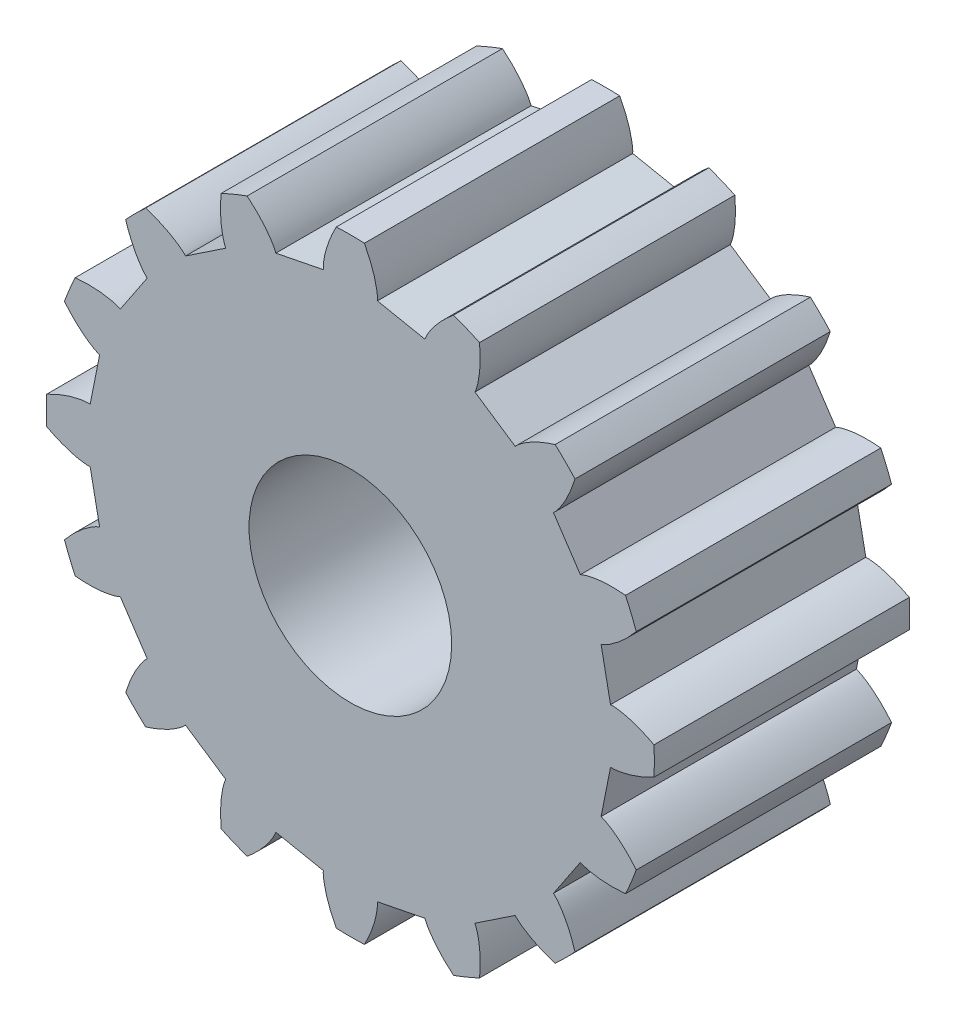
from build123d import *

# Parameters (mm, degrees)
SKETCH1_R               = 14.2875
BOSS_EXTRUDE1_DEPTH     = 12
CUT_EXTRUDE2_DEPTH      = 13
CIRPATTERN1_COUNT       = 16
CUT_EXTRUDE4_DEPTH      = 14
CUT_EXTRUDE4_DEPTH_BACK = 14
SKETCH3_R               = 4.7625


with BuildPart() as part:
    # Sketch1 → Boss-Extrude1 (new body)
    with BuildSketch(Plane.XY):
        Circle(SKETCH1_R)
    extrude(amount=BOSS_EXTRUDE1_DEPTH)

    # Sketch2 → Cut-Extrude2 (cut, symmetric)
    with BuildSketch(Plane.XY):
        with BuildLine():
            add(Edge.make_bspline(
                [(12.229398428, 1.272996615), (12.232569464, 1.273286616), (12.24147496, 1.27397705), (12.258355017, 1.274796659), (12.285950585, 1.275443331), (12.321178928, 1.275251476), (12.366773102, 1.273836189), (12.420546418, 1.270667153), (12.479687741, 1.26561074), (12.544059737, 1.258411302), (12.608289269, 1.249727247), (12.672354395, 1.239667418), (12.736156846, 1.228386466), (12.813405758, 1.213233983), (12.905973255, 1.192997232), (13.01403689, 1.166335588), (13.136405998, 1.132550383), (13.260856391, 1.094333587), (13.383078241, 1.05362131), (13.506236131, 1.00892567), (13.625159484, 0.963157367), (13.74827665, 0.911985231), (13.861717136, 0.862901529), (13.98829551, 0.803906078), (14.090299927, 0.755125575), (14.195197101, 0.701408819), (14.246179434, 0.67477432), (14.272203516, 0.660956172)],
                knots=[0, 0, 0, 0, 0, 0.005376749, 0.015083688, 0.02853182, 0.04661014, 0.064854849, 0.092110526, 0.119476176, 0.146842496, 0.174208854, 0.201574956, 0.228941013, 0.256307345, 0.307035032, 0.361767352, 0.416499661, 0.471231937, 0.525964282, 0.580696616, 0.635428982, 0.690161387, 0.744893688, 0.799626082, 0.854358407, 0.909090914, 0.909090914, 0.909090914, 0.909090914, 0.909090914], degree=4))
            Line((14.272203516, 0.660956172), (59.935762795, 2.775668965))
            add(Edge.make_bspline(
                [(59.935762795, 2.775668965), (59.931630356, 2.864901825), (59.922571104, 3.049480891), (59.902165694, 3.440419569), (59.877579242, 3.838864849), (59.840808515, 4.384473066), (59.791455691, 5.01973039), (59.724470289, 5.770803476), (59.636018849, 6.621628164), (59.535214074, 7.474533703), (59.422361052, 8.323878311), (59.297279712, 9.17280178), (59.160175965, 10.018977678), (59.010873176, 10.863801486), (58.849682784, 11.705714261), (58.676209407, 12.546100116), (58.491172454, 13.382667924), (58.293497058, 14.218465783), (58.085046948, 15.048188716), (57.862866002, 15.880024995), (57.631950551, 16.700058452), (57.384099029, 17.530991619), (57.133463512, 18.333578353), (56.889087073, 19.073728923), (56.697889707, 19.634977834), (56.527852443, 20.11504821), (56.4659571, 20.288017853), (56.435627038, 20.372039682)],
                knots=[0.083333333, 0.083333333, 0.083333333, 0.083333333, 0.083333333, 0.103174603, 0.123015873, 0.142857143, 0.162698412, 0.202380952, 0.242063492, 0.281746032, 0.321428571, 0.361111111, 0.400793651, 0.44047619, 0.48015873, 0.51984127, 0.55952381, 0.599206349, 0.638888889, 0.678571429, 0.718253968, 0.757936508, 0.797619048, 0.837301588, 0.876984127, 0.896825397, 0.916666667, 0.916666667, 0.916666667, 0.916666667, 0.916666667], degree=4))
            Line((56.435627038, 20.372039682), (13.438733689, 4.851091949))
            add(Edge.make_bspline(
                [(11.785645616, 3.503892648), (11.78868625, 3.504838225), (11.797178074, 3.507608333), (11.813086863, 3.513310832), (11.838829315, 3.523273751), (11.87130264, 3.536932305), (11.912884557, 3.555687995), (11.961351885, 3.579193959), (12.014056338, 3.606497881), (12.070773202, 3.63778339), (12.126790307, 3.670385988), (12.182129036, 3.704196722), (12.236757782, 3.739035103), (12.302327866, 3.78259605), (12.380104813, 3.836716418), (12.469739624, 3.902702728), (12.5698649, 3.980744818), (12.670217137, 4.063677637), (12.767555488, 4.148063154), (12.864234261, 4.236487024), (12.956590341, 4.324281419), (13.050753042, 4.418673208), (13.136774866, 4.507432431), (13.231141453, 4.610376567), (13.306713757, 4.694479276), (13.383069595, 4.784249498), (13.419978548, 4.82836666), (13.438733689, 4.851091949)],
                knots=[0, 0, 0, 0, 0, 0.005376749, 0.015083688, 0.02853182, 0.04661014, 0.064854849, 0.092110526, 0.119476176, 0.146842496, 0.174208854, 0.201574956, 0.228941013, 0.256307345, 0.307035032, 0.361767352, 0.416499661, 0.471231937, 0.525964282, 0.580696616, 0.635428982, 0.690161387, 0.744893688, 0.799626082, 0.854358407, 0.909090915, 0.909090915, 0.909090915, 0.909090915, 0.909090915], degree=4))
            Line((11.785645616, 3.503892648), (12.229398428, 1.272996615))
        make_face()
    cut_extrude2 = extrude(amount=CUT_EXTRUDE2_DEPTH, both=True, mode=Mode.SUBTRACT)

    # CirPattern1: Cut-Extrude2 ×16 about axis
    cirpattern1_axis = Axis((0, 0, -0.6), (0, 0, 1))
    for i in range(1, CIRPATTERN1_COUNT):
        add(cut_extrude2.rotate(cirpattern1_axis, i * 360 / CIRPATTERN1_COUNT), mode=Mode.SUBTRACT)

    # Sketch3 → Cut-Extrude4 (cut, two sides: drawn at the far end of the back side and taken through both)
    with BuildSketch(Plane.XY.offset(-CUT_EXTRUDE4_DEPTH_BACK)):
        Circle(SKETCH3_R)
    extrude(amount=CUT_EXTRUDE4_DEPTH + CUT_EXTRUDE4_DEPTH_BACK, mode=Mode.SUBTRACT)


solid = part.part
